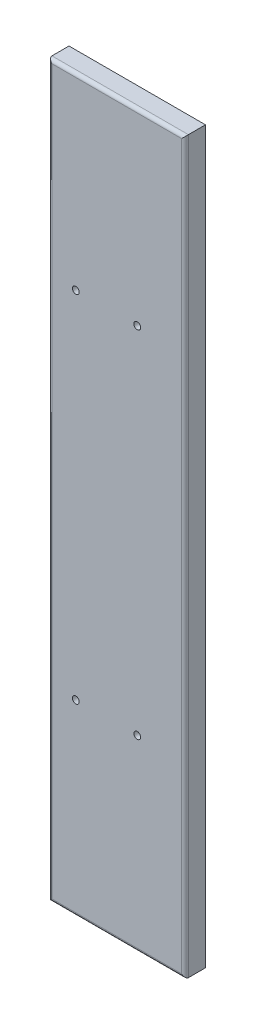
from build123d import *

# Parameters (mm, degrees)
SKETCH1_W                            = 127
SKETCH1_H                            = 679.45
BOSS_EXTRUDE1_DEPTH                  = 19.05
F_1_4_0_25_DIAMETER_HOLE1_AT_2_COUNT = 2
F_1_4_0_25_DIAMETER_HOLE1_AT_2_PITCH = 57.15
F_1_4_0_25_DIAMETER_HOLE1_AT_3_COUNT = 2
F_1_4_0_25_DIAMETER_HOLE1_AT_3_PITCH = 330.2
F_1_4_0_25_DIAMETER_HOLE1_AT_4_COUNT = 2
F_1_4_0_25_DIAMETER_HOLE1_AT_4_PITCH = 335.109179989
FILLET1_R                            = 3.175


with BuildPart() as part:
    # Sketch1 → Boss-Extrude1 (new body)
    with BuildSketch(Plane.XY):
        with Locations((9.525, -165.1)):
            Rectangle(SKETCH1_W, SKETCH1_H)
    extrude(amount=BOSS_EXTRUDE1_DEPTH)

    # Sketch4 → 1/4 (0.25) Diameter Hole1 (revolve, cut)
    with BuildSketch(Plane(origin=(-28.575000115, -330.2, 19.05), x_dir=(0, -1, 0), z_dir=(1, 0, 0))):
        Polygon((0, 0), (0, 19.05), (3.937, 19.05), (3.175, 18.173419274), (3.175, 0), align=None)
    f_1_4_0_25_diameter_hole1 = revolve(axis=Axis((-28.575000115, -330.2, 25.4), (0, 0, -1)), mode=Mode.SUBTRACT)

    # 1/4 (0.25) Diameter Hole1 at 2: 1/4 (0.25) Diameter Hole1 ×2
    with Locations(*[(i * F_1_4_0_25_DIAMETER_HOLE1_AT_2_PITCH, 0, 0) for i in range(1, F_1_4_0_25_DIAMETER_HOLE1_AT_2_COUNT)]):
        add(f_1_4_0_25_diameter_hole1, mode=Mode.SUBTRACT)

    # 1/4 (0.25) Diameter Hole1 at 3: 1/4 (0.25) Diameter Hole1 ×2
    with Locations(*[(0, i * F_1_4_0_25_DIAMETER_HOLE1_AT_3_PITCH, 0) for i in range(1, F_1_4_0_25_DIAMETER_HOLE1_AT_3_COUNT)]):
        add(f_1_4_0_25_diameter_hole1, mode=Mode.SUBTRACT)

    # 1/4 (0.25) Diameter Hole1 at 4: 1/4 (0.25) Diameter Hole1 ×2
    with Locations(*[Vector(0.17054143403781885, 0.9853505057979746, 0) * (i * F_1_4_0_25_DIAMETER_HOLE1_AT_4_PITCH) for i in range(1, F_1_4_0_25_DIAMETER_HOLE1_AT_4_COUNT)]):
        add(f_1_4_0_25_diameter_hole1, mode=Mode.SUBTRACT)

    # Fillet1
    fillet1_edges = [part.edges().sort_by_distance(p)[0] for p in [
        (9.525, -504.825, 19.05),
        (-53.975, -165.1, 19.05),
        (9.525, 174.625, 19.05),
        (73.025, -165.1, 19.05),
    ]]
    fillet(fillet1_edges, radius=FILLET1_R)


solid = part.part
